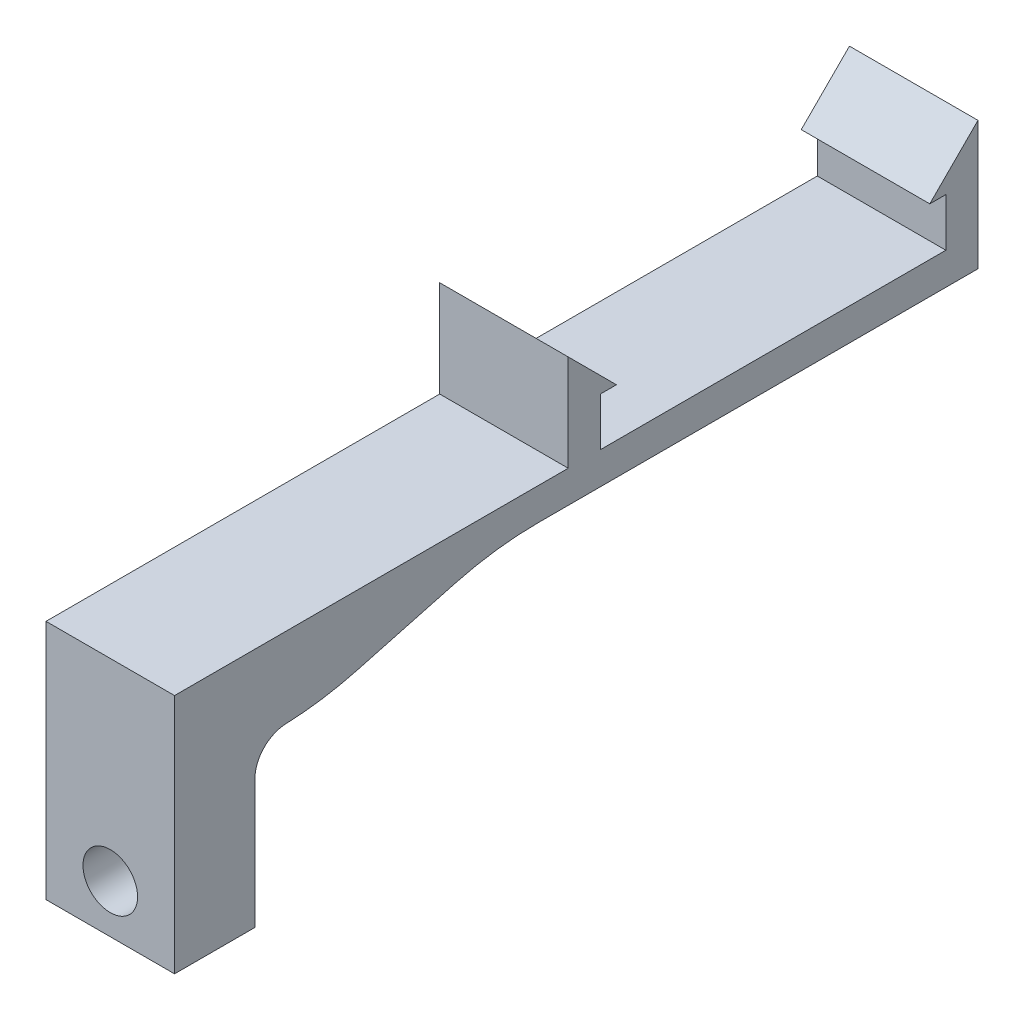
from build123d import *

# Parameters (mm, degrees)
SKETCH_1_W          = 8
SKETCH_1_H          = 15
EXTRUDE_1_DEPTH     = 5
SKETCH_2_W          = 8
SKETCH_2_H          = 5
EXTRUDE_2_DEPTH     = 45
EXTRUDE_3_DEPTH     = 8
CUT_EXTRUDE_1_DEPTH = 48.657633177
FILLET_1_R          = 20
FILLET_2_R          = 2
HOLE_WIZARD_M3_1_D  = 3.4


with BuildPart() as part:
    # ｽｹｯﾁ1 → ﾎﾞｽ - 押し出し1 (new body)
    with BuildSketch(Plane.XY):
        Rectangle(SKETCH_1_W, SKETCH_1_H)
    extrude(amount=EXTRUDE_1_DEPTH)

    # ｽｹｯﾁ2 → ﾎﾞｽ - 押し出し2 (add)
    with BuildSketch(Plane(origin=(0, 0, 0), x_dir=(-1, 0, 0), z_dir=(0, 0, -1))):
        with Locations((0, 5)):
            Rectangle(SKETCH_2_W, SKETCH_2_H)
    extrude(amount=EXTRUDE_2_DEPTH)

    # ｽｹｯﾁ4 → ﾎﾞｽ - 押し出し3 (add)
    with BuildSketch(Plane.ZY.offset(4)):
        Polygon((-45, 7.5), (-45, 13.5), (-42, 10.5), (-43, 10.5), (-43, 7.5), align=None)
        Polygon((-21.5, 7.5), (-21.5, 10.5), (-22.5, 10.5), (-19.5, 13.5), (-19.5, 7.5), align=None)
    extrude(amount=-EXTRUDE_3_DEPTH)

    # ｽｹｯﾁ5 → ｶｯﾄ - 押し出し1 (cut, through all)
    with BuildSketch(Plane.ZY.offset(4)):
        Polygon((-45, 2.5), (-45, 5.5), (-15, 5.5), (-3.803847577, 2.5), align=None)
    extrude(amount=-CUT_EXTRUDE_1_DEPTH, mode=Mode.SUBTRACT)

    # ﾌｨﾚｯﾄ1
    fillet_1_edges = [part.edges().sort_by_distance(p)[0] for p in [
        (0, 2.5, -3.803847577),
        (0, 5.5, -15),
    ]]
    fillet(fillet_1_edges, radius=FILLET_1_R)

    # ﾌｨﾚｯﾄ2
    fillet_2_edges = [part.edges().sort_by_distance(p)[0] for p in [
        (0, 2.5, 0),
    ]]
    fillet(fillet_2_edges, radius=FILLET_2_R)

    # M3 すきま穴1 (through all)
    with Locations(Plane.XY.offset(5)):
        with Locations((0, -4.5)):
            Hole(HOLE_WIZARD_M3_1_D / 2)


solid = part.part
